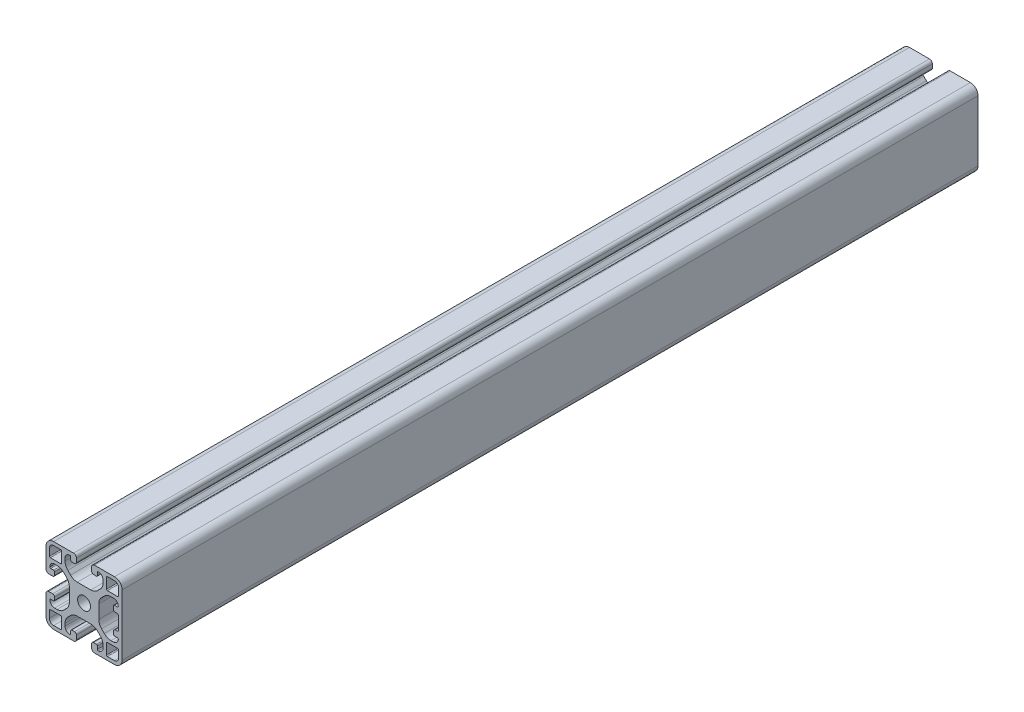
from build123d import *

# Parameters (mm, degrees)
SCHIZZO1_R                   = 3.4
ESTRUSIONE_ESTRUSIONE1_DEPTH = 450


with BuildPart() as part:
    # Schizzo1 → Estrusione-Estrusione1 (new body)
    with BuildSketch(Plane(origin=(0, 0, -340), x_dir=(-1, 0, 0), z_dir=(0, 0, -1))):
        with BuildLine():
            Line((6.5, -15.5), (5, -15.5))
            ThreePointArc((5, -15.5), (4.292893219, -15.792893219), (4, -16.5))
            Line((4, -16.5), (4, -18.5))
            ThreePointArc((4, -18.5), (4.439339828, -19.560660172), (5.5, -20))
            Line((5.5, -20), (16, -20))
            ThreePointArc((16, -20), (18.828427125, -18.828427125), (20, -16))
            Line((20, -16), (20, -5.5))
            ThreePointArc((20, -5.5), (19.560660172, -4.439339828), (18.5, -4))
            Line((18.5, -4), (16.5, -4))
            ThreePointArc((16.5, -4), (15.792893219, -4.292893219), (15.5, -5))
            Line((15.5, -5), (15.5, -6.5))
            ThreePointArc((15.5, -6.5), (15.646446609, -6.853553391), (16, -7))
            Line((16, -7), (17.55, -7))
            ThreePointArc((17.55, -7), (17.868198052, -7.131801948), (18, -7.45))
            Line((18, -7.45), (18, -7.5))
            ThreePointArc((18, -7.5), (17.267766953, -9.267766953), (15.5, -10))
            Line((15.5, -10), (14.192388155, -10))
            ThreePointArc((14.192388155, -10), (12.278970994, -9.619397663), (10.656854249, -8.535533906))
            Line((10.656854249, -8.535533906), (9.214466094, -7.09314575))
            ThreePointArc((9.214466094, -7.09314575), (8.130602337, -5.471029006), (7.75, -3.557611845))
            Line((7.75, -3.557611845), (7.75, 3.557611845))
            ThreePointArc((7.75, 3.557611845), (8.130602337, 5.471029006), (9.214466094, 7.09314575))
            Line((9.214466094, 7.09314575), (10.656854249, 8.535533906))
            ThreePointArc((10.656854249, 8.535533906), (12.278970994, 9.619397663), (14.192388155, 10))
            Line((14.192388155, 10), (15.5, 10))
            ThreePointArc((15.5, 10), (17.267766953, 9.267766953), (18, 7.5))
            Line((18, 7.5), (18, 7.45))
            ThreePointArc((18, 7.45), (17.868198052, 7.131801948), (17.55, 7))
            Line((17.55, 7), (16, 7))
            ThreePointArc((16, 7), (15.646446609, 6.853553391), (15.5, 6.5))
            Line((15.5, 6.5), (15.5, 5))
            ThreePointArc((15.5, 5), (15.792893219, 4.292893219), (16.5, 4))
            Line((16.5, 4), (18.5, 4))
            ThreePointArc((18.5, 4), (19.560660172, 4.439339828), (20, 5.5))
            Line((20, 5.5), (20, 16))
            ThreePointArc((20, 16), (18.828427125, 18.828427125), (16, 20))
            Line((16, 20), (5.5, 20))
            ThreePointArc((5.5, 20), (4.439339828, 19.560660172), (4, 18.5))
            Line((4, 18.5), (4, 16.5))
            ThreePointArc((4, 16.5), (4.292893219, 15.792893219), (5, 15.5))
            Line((5, 15.5), (6.5, 15.5))
            ThreePointArc((6.5, 15.5), (6.853553391, 15.646446609), (7, 16))
            Line((7, 16), (7, 17.55))
            ThreePointArc((7, 17.55), (7.131801948, 17.868198052), (7.45, 18))
            Line((7.45, 18), (7.5, 18))
            ThreePointArc((7.5, 18), (9.267766953, 17.267766953), (10, 15.5))
            Line((10, 15.5), (10, 14.192388155))
            ThreePointArc((10, 14.192388155), (9.619397663, 12.278970994), (8.535533906, 10.656854249))
            Line((8.535533906, 10.656854249), (7.09314575, 9.214466094))
            ThreePointArc((7.09314575, 9.214466094), (5.471029006, 8.130602337), (3.557611844, 7.75))
            Line((3.557611844, 7.75), (-3.557611845, 7.75))
            ThreePointArc((-3.557611845, 7.75), (-5.471029006, 8.130602337), (-7.09314575, 9.214466094))
            Line((-7.09314575, 9.214466094), (-8.535533906, 10.656854249))
            ThreePointArc((-8.535533906, 10.656854249), (-9.619397663, 12.278970994), (-10, 14.192388155))
            Line((-10, 14.192388155), (-10, 15.5))
            ThreePointArc((-10, 15.5), (-9.267766953, 17.267766953), (-7.5, 18))
            Line((-7.5, 18), (-7.45, 18))
            ThreePointArc((-7.45, 18), (-7.131801948, 17.868198052), (-7, 17.55))
            Line((-7, 17.55), (-7, 16))
            ThreePointArc((-7, 16), (-6.853553391, 15.646446609), (-6.5, 15.5))
            Line((-6.5, 15.5), (-5, 15.5))
            ThreePointArc((-5, 15.5), (-4.292893219, 15.792893219), (-4, 16.5))
            Line((-4, 16.5), (-4, 18.5))
            ThreePointArc((-4, 18.5), (-4.439339828, 19.560660172), (-5.5, 20))
            Line((-5.5, 20), (-16, 20))
            ThreePointArc((-16, 20), (-18.828427125, 18.828427125), (-20, 16))
            Line((-20, 16), (-20, -16))
            ThreePointArc((-20, -16), (-18.828427125, -18.828427125), (-16, -20))
            Line((-16, -20), (-5.5, -20))
            ThreePointArc((-5.5, -20), (-4.439339828, -19.560660172), (-4, -18.5))
            Line((-4, -18.5), (-4, -16.5))
            ThreePointArc((-4, -16.5), (-4.292893219, -15.792893219), (-5, -15.5))
            Line((-5, -15.5), (-6.5, -15.5))
            ThreePointArc((-6.5, -15.5), (-6.853553391, -15.646446609), (-7, -16))
            Line((-7, -16), (-7, -17.55))
            ThreePointArc((-7, -17.55), (-7.131801948, -17.868198052), (-7.45, -18))
            Line((-7.45, -18), (-7.5, -18))
            ThreePointArc((-7.5, -18), (-9.267766953, -17.267766953), (-10, -15.5))
            Line((-10, -15.5), (-10, -14.192388155))
            ThreePointArc((-10, -14.192388155), (-9.619397663, -12.278970994), (-8.535533906, -10.656854249))
            Line((-8.535533906, -10.656854249), (-7.09314575, -9.214466094))
            ThreePointArc((-7.09314575, -9.214466094), (-5.471029006, -8.130602337), (-3.557611845, -7.75))
            Line((-3.557611845, -7.75), (3.557611845, -7.75))
            ThreePointArc((3.557611845, -7.75), (5.471029006, -8.130602337), (7.09314575, -9.214466094))
            Line((7.09314575, -9.214466094), (8.535533906, -10.656854249))
            ThreePointArc((8.535533906, -10.656854249), (9.619397663, -12.278970994), (10, -14.192388155))
            Line((10, -14.192388155), (10, -15.5))
            ThreePointArc((10, -15.5), (9.267766953, -17.267766953), (7.5, -18))
            Line((7.5, -18), (7.45, -18))
            ThreePointArc((7.45, -18), (7.131801948, -17.868198052), (7, -17.55))
            Line((7, -17.55), (7, -16))
            ThreePointArc((7, -16), (6.853553391, -15.646446609), (6.5, -15.5))
        make_face()
        with Locations(Location((0, 0, 0), (0, 0, 180))):
            Circle(SCHIZZO1_R, mode=Mode.SUBTRACT)
        with BuildLine():
            Line((-12.3, -18.2), (-16, -18.2))
            ThreePointArc((-16, -18.2), (-17.555634919, -17.555634919), (-18.2, -16))
            Line((-18.2, -16), (-18.2, -12.3))
            ThreePointArc((-18.2, -12.3), (-18.053553391, -11.946446609), (-17.7, -11.8))
            Line((-17.7, -11.8), (-12.3, -11.8))
            ThreePointArc((-12.3, -11.8), (-11.946446609, -11.946446609), (-11.8, -12.3))
            Line((-11.8, -12.3), (-11.8, -17.7))
            ThreePointArc((-11.8, -17.7), (-11.946446609, -18.053553391), (-12.3, -18.2))
        make_face(mode=Mode.SUBTRACT)
        with BuildLine():
            Line((-11.8, 17.7), (-11.8, 12.3))
            ThreePointArc((-11.8, 12.3), (-11.946446609, 11.946446609), (-12.3, 11.8))
            Line((-12.3, 11.8), (-17.7, 11.8))
            ThreePointArc((-17.7, 11.8), (-18.053553391, 11.946446609), (-18.2, 12.3))
            Line((-18.2, 12.3), (-18.2, 16))
            ThreePointArc((-18.2, 16), (-17.555634919, 17.555634919), (-16, 18.2))
            Line((-16, 18.2), (-12.3, 18.2))
            ThreePointArc((-12.3, 18.2), (-11.946446609, 18.053553391), (-11.8, 17.7))
        make_face(mode=Mode.SUBTRACT)
        with BuildLine():
            Line((18.2, 16), (18.2, 12.3))
            ThreePointArc((18.2, 12.3), (18.053553391, 11.946446609), (17.7, 11.8))
            Line((17.7, 11.8), (12.3, 11.8))
            ThreePointArc((12.3, 11.8), (11.946446609, 11.946446609), (11.8, 12.3))
            Line((11.8, 12.3), (11.8, 17.7))
            ThreePointArc((11.8, 17.7), (11.946446609, 18.053553391), (12.3, 18.2))
            Line((12.3, 18.2), (16, 18.2))
            ThreePointArc((16, 18.2), (17.555634919, 17.555634919), (18.2, 16))
        make_face(mode=Mode.SUBTRACT)
        with BuildLine():
            Line((18.2, -12.3), (18.2, -16))
            ThreePointArc((18.2, -16), (17.555634919, -17.555634919), (16, -18.2))
            Line((16, -18.2), (12.3, -18.2))
            ThreePointArc((12.3, -18.2), (11.946446609, -18.053553391), (11.8, -17.7))
            Line((11.8, -17.7), (11.8, -12.3))
            ThreePointArc((11.8, -12.3), (11.946446609, -11.946446609), (12.3, -11.8))
            Line((12.3, -11.8), (17.7, -11.8))
            ThreePointArc((17.7, -11.8), (18.053553391, -11.946446609), (18.2, -12.3))
        make_face(mode=Mode.SUBTRACT)
        with BuildLine():
            Line((-16, 7), (-17.5, 7))
            ThreePointArc((-17.5, 7), (-17.853553391, 7.146446609), (-18, 7.5))
            ThreePointArc((-18, 7.5), (-17.267766953, 9.267766953), (-15.5, 10))
            Line((-15.5, 10), (-14.192388155, 10))
            ThreePointArc((-14.192388155, 10), (-12.278970994, 9.619397663), (-10.656854249, 8.535533906))
            Line((-10.656854249, 8.535533906), (-9.214466094, 7.093145751))
            ThreePointArc((-9.214466094, 7.093145751), (-8.130602337, 5.471029006), (-7.75, 3.557611845))
            Line((-7.75, 3.557611845), (-7.75, -3.557611845))
            ThreePointArc((-7.75, -3.557611845), (-8.130602337, -5.471029006), (-9.214466094, -7.093145751))
            Line((-9.214466094, -7.093145751), (-10.656854249, -8.535533906))
            ThreePointArc((-10.656854249, -8.535533906), (-12.278970994, -9.619397663), (-14.192388155, -10))
            Line((-14.192388155, -10), (-15.5, -10))
            ThreePointArc((-15.5, -10), (-17.267766953, -9.267766953), (-18, -7.5))
            ThreePointArc((-18, -7.5), (-17.853553391, -7.146446609), (-17.5, -7))
            Line((-17.5, -7), (-16, -7))
            ThreePointArc((-16, -7), (-15.646446609, -6.853553391), (-15.5, -6.5))
            Line((-15.5, -6.5), (-15.5, -5))
            ThreePointArc((-15.5, -5), (-15.792893219, -4.292893219), (-16.5, -4))
            Line((-16.5, -4), (-17.5, -4))
            ThreePointArc((-17.5, -4), (-17.853553391, -3.853553391), (-18, -3.5))
            Line((-18, -3.5), (-18, 3.5))
            ThreePointArc((-18, 3.5), (-17.853553391, 3.853553391), (-17.5, 4))
            Line((-17.5, 4), (-16.5, 4))
            ThreePointArc((-16.5, 4), (-15.792893219, 4.292893219), (-15.5, 5))
            Line((-15.5, 5), (-15.5, 6.5))
            ThreePointArc((-15.5, 6.5), (-15.646446609, 6.853553391), (-16, 7))
        make_face(mode=Mode.SUBTRACT)
    extrude(amount=-ESTRUSIONE_ESTRUSIONE1_DEPTH)


solid = part.part
